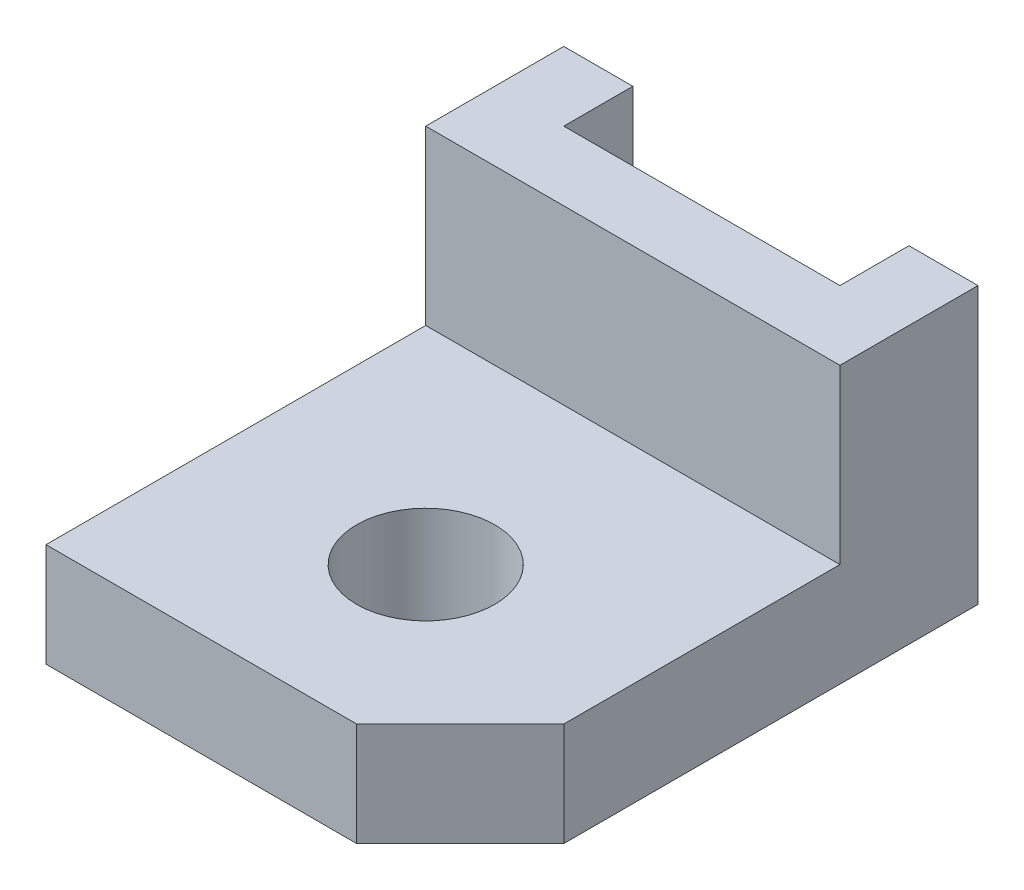
from build123d import *

# Parameters (mm, degrees)
SKETCH1_R           = 10
BOSS_EXTRUDE1_DEPTH = 15
BOSS_EXTRUDE2_DEPTH = 25
SKETCH3_W           = 40
SKETCH3_H           = 10
CUT_EXTRUDE1_DEPTH  = 71.710678119


with BuildPart() as part:
    # Sketch1 → Boss-Extrude1 (new body)
    with BuildSketch(Plane(origin=(0, 0, 0), x_dir=(-1, 0, 0), z_dir=(0, 1, 0))):
        Polygon((-30, -50), (30, -50), (30, 25), (-15, 25), (-30, 10), align=None)
        with Locations(Location((0, 0, 0), (0, 0, 90))):
            Circle(SKETCH1_R, mode=Mode.SUBTRACT)
    extrude(amount=BOSS_EXTRUDE1_DEPTH)

    # Sketch2 → Boss-Extrude2 (add)
    with BuildSketch(Plane(origin=(0, 15, 0), x_dir=(-1, 0, 0), z_dir=(0, 1, 0))):
        Polygon((-30, -50), (-30, -30), (30, -30), (30, -50), (20, -50), (20, -40), (-20, -40), (-20, -50), align=None)
    extrude(amount=BOSS_EXTRUDE2_DEPTH)

    # Sketch3 → Cut-Extrude1 (cut, through all)
    with BuildSketch(Plane(origin=(0, 40, 0), x_dir=(-1, 0, 0), z_dir=(0, 1, 0))):
        with Locations((0, -45)):
            Rectangle(SKETCH3_W, SKETCH3_H)
    extrude(amount=-CUT_EXTRUDE1_DEPTH, mode=Mode.SUBTRACT)


solid = part.part
